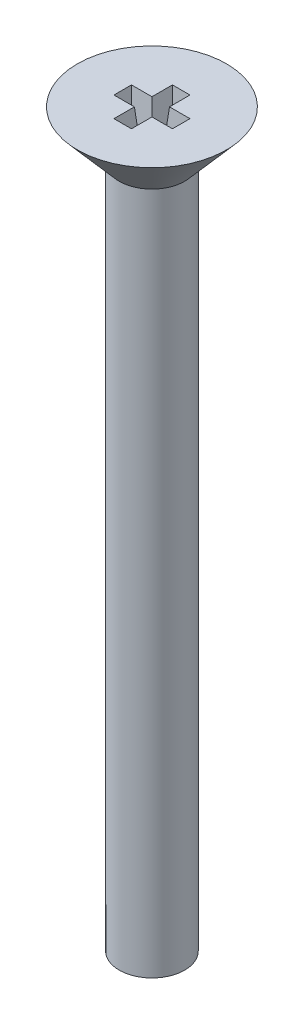
from build123d import *

# Parameters (mm, degrees)
CUT_EXTRUDE1_DEPTH = 2.159
CUT_EXTRUDE1_DRAFT = -5


with BuildPart() as part:
    # Sketch1 → Revolve1 (revolve)
    with BuildSketch(Plane.XY, mode=Mode.PRIVATE) as revolve1_sk:
        Polygon((1.4224, 0), (3.2385, 2.089184064), (0, 2.089184064), (0, 0), (0, -29.660815936), (1.4224, -29.660815936), align=None)
    revolve(revolve1_sk.sketch.rotate(Axis((0, 0, 0), (0, -1, 0)), 180), axis=Axis((0, 0, 0), (0, -1, 0)))


with BuildPart() as cut_extrude1_tool:
    # Sketch2 → Cut-Extrude1 (with draft: the straight prism first)
    with BuildSketch(Plane(origin=(0, 2.089184064, 0), x_dir=(1, 0, 0), z_dir=(0, 1, 0))):
        Polygon((-0.381, 1.27), (-0.381, 0.381), (-1.27, 0.381), (-1.27, -0.381), (-0.381, -0.381), (-0.381, -1.27), (0.381, -1.27), (0.381, -0.381), (1.27, -0.381), (1.27, 0.381), (0.381, 0.381), (0.381, 1.27), align=None)
    extrude(amount=-CUT_EXTRUDE1_DEPTH)
    # Cut-Extrude1: the draft: its side faces are tilted about the plane it starts from
    cut_extrude1_sides = [cut_extrude1_tool.faces().sort_by_distance(p)[0] for p in [
        (-0.381, 1.009684064, -0.8255),
        (-0.8255, 1.009684064, -0.381),
        (-1.27, 1.009684064, 0),
        (-0.8255, 1.009684064, 0.381),
        (-0.381, 1.009684064, 0.8255),
        (0, 1.009684064, 1.27),
        (0.381, 1.009684064, 0.8255),
        (0.8255, 1.009684064, 0.381),
        (1.27, 1.009684064, 0),
        (0.8255, 1.009684064, -0.381),
        (0.381, 1.009684064, -0.8255),
        (0, 1.009684064, -1.27),
    ]]
    draft(cut_extrude1_sides, Plane(origin=(0, 2.089184064, 0), x_dir=(1, 0, 0), z_dir=(0, 1, 0)), CUT_EXTRUDE1_DRAFT)


with BuildPart() as part_1:
    add(part.part)

    # Cut-Extrude1: cut by cut_extrude1_tool
    add(cut_extrude1_tool.part, mode=Mode.SUBTRACT)


solid = part_1.part
